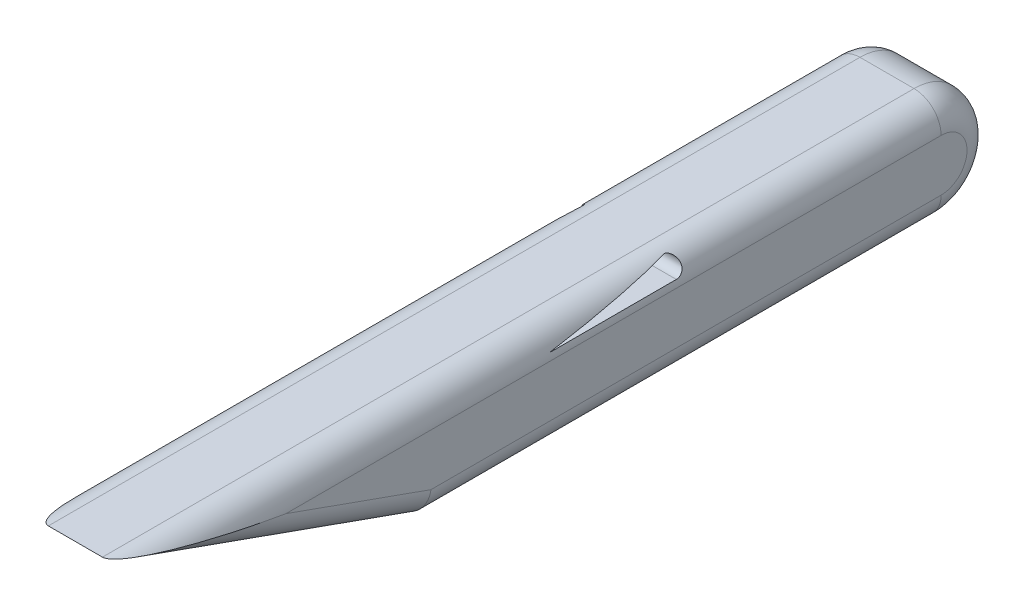
from build123d import *

# Parameters (mm, degrees)
BOSS_EXTRUDE1_DEPTH = 100
FILLET1_R           = 50
CUT_EXTRUDE1_DEPTH  = 300


with BuildPart() as part:
    # Sketch1 → Boss-Extrude1 (new, symmetric)
    with BuildSketch(Plane(origin=(0, 0, 0), x_dir=(0, 0, -1), z_dir=(1, 0, 0))):
        with BuildLine():
            Line((-537.016574586, 60.497237569), (11.602209945, -135.082872928))
            Line((11.602209945, -135.082872928), (962.983425414, -135.082872928))
            ThreePointArc((962.983425414, -135.082872928), (1060.773480663, -37.29281768), (962.983425414, 60.497237569))
            Line((962.983425414, 60.497237569), (-537.016574586, 60.497237569))
        make_face()
    extrude(amount=BOSS_EXTRUDE1_DEPTH, both=True)

    # Fillet1
    fillet1_edges = [part.edges().sort_by_distance(p)[0] for p in [
        (-100, -135.082872928, -487.29281768),
        (-100, -37.29281768, 262.70718232),
        (-100, 60.497237569, -212.983425414),
        (100, -37.29281768, 262.70718232),
        (100, -135.082872928, -487.29281768),
        (100, -37.29281768, -1060.773480663),
        (100, 60.497237569, -212.983425414),
        (-100, -37.29281768, -1060.773480663),
    ]]
    fillet(fillet1_edges, radius=FILLET1_R)

    # Sketch2 → Cut-Extrude1 (cut)
    with BuildSketch(Plane.ZY.offset(100)):
        with BuildLine():
            Line((-240.278412459, 23.075070398), (-475.216763111, 23.075070398))
            ThreePointArc((-475.216763111, 23.075070398), (-490.247556178, 39.100328004), (-473.293494818, 53.075070398))
            Line((-473.293494818, 53.075070398), (-240.278412459, 23.075070398))
        make_face()
    extrude(amount=-CUT_EXTRUDE1_DEPTH, mode=Mode.SUBTRACT)


solid = part.part
